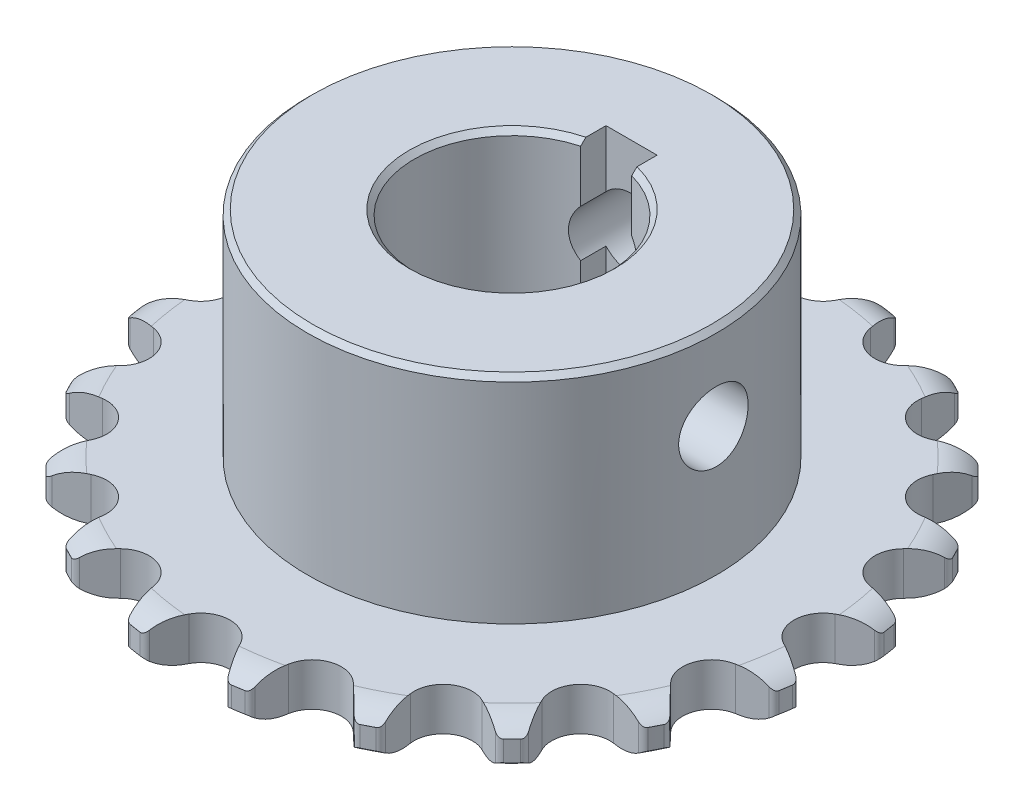
from build123d import *

# Parameters (mm, degrees)
CROQUIS1_R              = 20
CROQUIS1_R_2            = 9.55
SALIENTE_EXTRUIR1_DEPTH = 25.2
CROQUIS2_W              = 5
CROQUIS2_H              = 11.7
CORTAR_EXTRUIR1_DEPTH   = 38.88192181
CROQUIS4_R              = 3.4
CORTAR_EXTRUIR2_DEPTH   = 38.88192181
CROQUIS5_R              = 3.4
CORTAR_EXTRUIR3_DEPTH   = 38.881921982
CROQUIS6_R              = 32.25
CROQUIS6_R_2            = 18
SALIENTE_EXTRUIR2_DEPTH = 4.2
CROQUIS11_R             = 2.85
CORTAR_EXTRUIR9_DEPTH   = 51.210805652
CORTAR_EXTRUIR10_DEPTH  = 51.107839886
REDONDEO4_R             = 0.6
CHAFL_N3_SIZE           = 0.5


with BuildPart() as part:
    # Croquis1 → Saliente-Extruir1 (new body)
    with BuildSketch(Plane(origin=(0, 0, 0), x_dir=(1, 0, 0), z_dir=(0, 1, 0))):
        with Locations(Location((0, 0, 0), (0, 0, 270))):
            Circle(CROQUIS1_R)
        with Locations(Location((0, 0, 0), (0, 0, 270))):
            Circle(CROQUIS1_R_2, mode=Mode.SUBTRACT)
    extrude(amount=SALIENTE_EXTRUIR1_DEPTH)

    # Croquis2 → Cortar-Extruir1 (cut, through all)
    with BuildSketch(Plane(origin=(0, 25.2, 0), x_dir=(1, 0, 0), z_dir=(0, 1, 0))):
        with Locations((0, 5.85)):
            Rectangle(CROQUIS2_W, CROQUIS2_H)
    extrude(amount=-CORTAR_EXTRUIR1_DEPTH, mode=Mode.SUBTRACT)

    # Croquis4 → Cortar-Extruir2 (cut, through all)
    with BuildSketch(Plane.XY):
        with Locations(Location((0, 17.3, 0), (0, 0, 42.667925494))):
            Circle(CROQUIS4_R)
    extrude(amount=-CORTAR_EXTRUIR2_DEPTH, mode=Mode.SUBTRACT)

    # Croquis5 → Cortar-Extruir3 (cut, through all)
    with BuildSketch(Plane(origin=(0, 0, 0), x_dir=(0, 0, -1), z_dir=(1, 0, 0))):
        with Locations(Location((0, 16.8, 0), (0, 0, 180))):
            Circle(CROQUIS5_R)
    extrude(amount=CORTAR_EXTRUIR3_DEPTH, mode=Mode.SUBTRACT)

    # Croquis6 → Saliente-Extruir2 (add)
    with BuildSketch(Plane.XZ):
        with Locations(Location((0, 0, 0), (0, 0, 270))):
            Circle(CROQUIS6_R)
        Circle(CROQUIS6_R_2, mode=Mode.SUBTRACT)
    extrude(amount=-SALIENTE_EXTRUIR2_DEPTH)

    # Croquis11 → Cortar-Extruir9 (cut, through all)
    with BuildSketch(Plane(origin=(0, 4.2, 0), x_dir=(1, 0, 0), z_dir=(0, 1, 0))):
        with Locations((0, 30.45)):
            Circle(CROQUIS11_R)
        with Locations((9.409567479, 28.959670921)):
            Circle(CROQUIS11_R)
        with Locations((17.898060932, 24.634567479)):
            Circle(CROQUIS11_R)
        with Locations((24.634567479, 17.898060932)):
            Circle(CROQUIS11_R)
        with Locations((28.959670921, 9.409567479)):
            Circle(CROQUIS11_R)
        with Locations((30.45, 0)):
            Circle(CROQUIS11_R)
        with Locations((28.959670921, -9.409567479)):
            Circle(CROQUIS11_R)
        with Locations((24.634567479, -17.898060932)):
            Circle(CROQUIS11_R)
        with Locations((17.898060932, -24.634567479)):
            Circle(CROQUIS11_R)
        with Locations((9.409567479, -28.959670921)):
            Circle(CROQUIS11_R)
        with Locations((0, -30.45)):
            Circle(CROQUIS11_R)
        with Locations((-9.409567479, -28.959670921)):
            Circle(CROQUIS11_R)
        with Locations((-17.898060932, -24.634567479)):
            Circle(CROQUIS11_R)
        with Locations((-24.634567479, -17.898060932)):
            Circle(CROQUIS11_R)
        with Locations((-28.959670921, -9.409567479)):
            Circle(CROQUIS11_R)
        with Locations((-30.45, 0)):
            Circle(CROQUIS11_R)
        with Locations((-28.959670921, 9.409567479)):
            Circle(CROQUIS11_R)
        with Locations((-24.634567479, 17.898060932)):
            Circle(CROQUIS11_R)
        with Locations((-17.898060932, 24.634567479)):
            Circle(CROQUIS11_R)
        with Locations((-9.409567479, 28.959670921)):
            Circle(CROQUIS11_R)
    extrude(amount=-CORTAR_EXTRUIR9_DEPTH, mode=Mode.SUBTRACT)

    # Croquis12 → Cortar-Extruir10 (cut, through all)
    with BuildSketch(Plane(origin=(0, 4.2, 0), x_dir=(1, 0, 0), z_dir=(0, 1, 0))):
        with BuildLine():
            Line((2.514154961, 29.107791063), (4.055016529, 31.994051649))
            Line((4.055016529, 31.994051649), (3.555016529, 32.894051649))
            Line((3.555016529, 32.894051649), (2.272596109, 32.169827586))
            ThreePointArc((2.272596109, 32.169827586), (2.841172886, 30.674135296), (2.514154961, 29.107791063))
        make_face()
        with BuildLine():
            Line((6.030392044, 31.681175354), (6.603664339, 28.460263701))
            ThreePointArc((6.603664339, 28.460263701), (6.776750582, 30.050897381), (7.779656092, 31.297594973))
            Line((7.779656092, 31.297594973), (6.530392044, 32.429506831))
            Line((6.530392044, 32.429506831), (6.030392044, 31.681175354))
        make_face()
        with BuildLine():
            Line((11.385905566, 26.906237756), (13.743255572, 29.175082284))
            Line((13.743255572, 29.175082284), (13.545842609, 30.185541646))
            Line((13.545842609, 30.185541646), (12.102390768, 29.893053335))
            ThreePointArc((12.102390768, 29.893053335), (12.180945081, 28.294865549), (11.385905566, 26.906237756))
        make_face()
        with BuildLine():
            Line((15.525265235, 28.26709464), (15.075163149, 25.026674743))
            ThreePointArc((15.075163149, 25.026674743), (15.731310787, 26.485970678), (17.070381351, 27.361735701))
            Line((17.070381351, 27.361735701), (16.232040637, 28.824291671))
            Line((16.232040637, 28.824291671), (15.525265235, 28.26709464))
        make_face()
        with BuildLine():
            Line((19.143124403, 22.07091443), (22.086209005, 23.50025259))
            Line((22.086209005, 23.50025259), (22.210707235, 24.522260511))
            Line((22.210707235, 24.522260511), (20.747519097, 24.690138746))
            ThreePointArc((20.747519097, 24.690138746), (20.328361503, 23.14589722), (19.143124403, 22.07091443))
        make_face()
        with BuildLine():
            Line((23.500417294, 22.086033754), (22.070999955, 19.143300489))
            ThreePointArc((22.070999955, 19.143300489), (23.145980686, 20.328412627), (24.690138746, 20.747519097))
            Line((24.690138746, 20.747519097), (24.344783998, 22.397554011))
            Line((24.344783998, 22.397554011), (23.500417294, 22.086033754))
        make_face()
        with BuildLine():
            Line((25.026480847, 15.075136223), (28.267210417, 15.525054436))
            Line((28.267210417, 15.525054436), (28.701433086, 16.458569661))
            Line((28.701433086, 16.458569661), (27.361735701, 17.070381351))
            ThreePointArc((27.361735701, 17.070381351), (26.485896264, 15.731247205), (25.026480847, 15.075136223))
        make_face()
        with BuildLine():
            Line((29.175184772, 13.743038002), (26.906373508, 11.386046604))
            ThreePointArc((26.906373508, 11.386046604), (28.294960728, 12.180967911), (29.893053335, 12.102390768))
            Line((29.893053335, 12.102390768), (30.074490281, 13.778387711))
            Line((30.074490281, 13.778387711), (29.175184772, 13.743038002))
        make_face()
        with BuildLine():
            Line((28.460070975, 6.603698648), (31.681220324, 6.030155785))
            Line((31.681220324, 6.030155785), (32.382662691, 6.783799338))
            Line((32.382662691, 6.783799338), (31.297594973, 7.779656092))
            ThreePointArc((31.297594973, 7.779656092), (30.05080696, 6.776713107), (28.460070975, 6.603698648))
        make_face()
        with BuildLine():
            Line((31.994081888, 4.054777937), (29.107963754, 2.514247147))
            ThreePointArc((29.107963754, 2.514247147), (30.674232871, 2.841165187), (32.169827586, 2.272596109))
            Line((32.169827586, 2.272596109), (32.860295913, 3.810496823))
            Line((32.860295913, 3.810496823), (31.994081888, 4.054777937))
        make_face()
        with BuildLine():
            Line((29.107791063, -2.514154961), (31.994051649, -4.055016529))
            Line((31.994051649, -4.055016529), (32.894051649, -3.555016529))
            Line((32.894051649, -3.555016529), (32.169827586, -2.272596109))
            ThreePointArc((32.169827586, -2.272596109), (30.674135296, -2.841172886), (29.107791063, -2.514154961))
        make_face()
        with BuildLine():
            Line((31.681175354, -6.030392044), (28.460263701, -6.603664339))
            ThreePointArc((28.460263701, -6.603664339), (30.050897381, -6.776750582), (31.297594973, -7.779656092))
            Line((31.297594973, -7.779656092), (32.429506831, -6.530392044))
            Line((32.429506831, -6.530392044), (31.681175354, -6.030392044))
        make_face()
        with BuildLine():
            Line((26.906237756, -11.385905566), (29.175082284, -13.743255572))
            Line((29.175082284, -13.743255572), (30.185541646, -13.545842609))
            Line((30.185541646, -13.545842609), (29.893053335, -12.102390768))
            ThreePointArc((29.893053335, -12.102390768), (28.294865549, -12.180945081), (26.906237756, -11.385905566))
        make_face()
        with BuildLine():
            Line((28.26709464, -15.525265235), (25.026674743, -15.075163149))
            ThreePointArc((25.026674743, -15.075163149), (26.485970678, -15.731310787), (27.361735701, -17.070381351))
            Line((27.361735701, -17.070381351), (28.824291671, -16.232040637))
            Line((28.824291671, -16.232040637), (28.26709464, -15.525265235))
        make_face()
        with BuildLine():
            Line((22.07091443, -19.143124403), (23.50025259, -22.086209005))
            Line((23.50025259, -22.086209005), (24.522260511, -22.210707235))
            Line((24.522260511, -22.210707235), (24.690138746, -20.747519097))
            ThreePointArc((24.690138746, -20.747519097), (23.14589722, -20.328361503), (22.07091443, -19.143124403))
        make_face()
        with BuildLine():
            Line((22.086033754, -23.500417294), (19.143300489, -22.070999955))
            ThreePointArc((19.143300489, -22.070999955), (20.328412627, -23.145980686), (20.747519097, -24.690138746))
            Line((20.747519097, -24.690138746), (22.397554011, -24.344783998))
            Line((22.397554011, -24.344783998), (22.086033754, -23.500417294))
        make_face()
        with BuildLine():
            Line((15.075136223, -25.026480847), (15.525054436, -28.267210417))
            Line((15.525054436, -28.267210417), (16.458569661, -28.701433086))
            Line((16.458569661, -28.701433086), (17.070381351, -27.361735701))
            ThreePointArc((17.070381351, -27.361735701), (15.731247205, -26.485896264), (15.075136223, -25.026480847))
        make_face()
        with BuildLine():
            Line((13.743038002, -29.175184772), (11.386046604, -26.906373508))
            ThreePointArc((11.386046604, -26.906373508), (12.180967911, -28.294960728), (12.102390768, -29.893053335))
            Line((12.102390768, -29.893053335), (13.778387711, -30.074490281))
            Line((13.778387711, -30.074490281), (13.743038002, -29.175184772))
        make_face()
        with BuildLine():
            Line((6.603698648, -28.460070975), (6.030155785, -31.681220324))
            Line((6.030155785, -31.681220324), (6.783799338, -32.382662691))
            Line((6.783799338, -32.382662691), (7.779656092, -31.297594973))
            ThreePointArc((7.779656092, -31.297594973), (6.776713107, -30.05080696), (6.603698648, -28.460070975))
        make_face()
        with BuildLine():
            Line((4.054777937, -31.994081888), (2.514247147, -29.107963754))
            ThreePointArc((2.514247147, -29.107963754), (2.841165187, -30.674232871), (2.272596109, -32.169827586))
            Line((2.272596109, -32.169827586), (3.810496823, -32.860295913))
            Line((3.810496823, -32.860295913), (4.054777937, -31.994081888))
        make_face()
        with BuildLine():
            Line((-2.514154961, -29.107791063), (-4.055016529, -31.994051649))
            Line((-4.055016529, -31.994051649), (-3.555016529, -32.894051649))
            Line((-3.555016529, -32.894051649), (-2.272596109, -32.169827586))
            ThreePointArc((-2.272596109, -32.169827586), (-2.841172886, -30.674135296), (-2.514154961, -29.107791063))
        make_face()
        with BuildLine():
            Line((-6.030392044, -31.681175354), (-6.603664339, -28.460263701))
            ThreePointArc((-6.603664339, -28.460263701), (-6.776750582, -30.050897381), (-7.779656092, -31.297594973))
            Line((-7.779656092, -31.297594973), (-6.530392044, -32.429506831))
            Line((-6.530392044, -32.429506831), (-6.030392044, -31.681175354))
        make_face()
        with BuildLine():
            Line((-11.385905566, -26.906237756), (-13.743255572, -29.175082284))
            Line((-13.743255572, -29.175082284), (-13.545842609, -30.185541646))
            Line((-13.545842609, -30.185541646), (-12.102390768, -29.893053335))
            ThreePointArc((-12.102390768, -29.893053335), (-12.180945081, -28.294865549), (-11.385905566, -26.906237756))
        make_face()
        with BuildLine():
            Line((-15.525265235, -28.26709464), (-15.075163149, -25.026674743))
            ThreePointArc((-15.075163149, -25.026674743), (-15.731310787, -26.485970678), (-17.070381351, -27.361735701))
            Line((-17.070381351, -27.361735701), (-16.232040637, -28.824291671))
            Line((-16.232040637, -28.824291671), (-15.525265235, -28.26709464))
        make_face()
        with BuildLine():
            Line((-19.143124403, -22.07091443), (-22.086209005, -23.50025259))
            Line((-22.086209005, -23.50025259), (-22.210707235, -24.522260511))
            Line((-22.210707235, -24.522260511), (-20.747519097, -24.690138746))
            ThreePointArc((-20.747519097, -24.690138746), (-20.328361503, -23.14589722), (-19.143124403, -22.07091443))
        make_face()
        with BuildLine():
            Line((-23.500417294, -22.086033754), (-22.070999955, -19.143300489))
            ThreePointArc((-22.070999955, -19.143300489), (-23.145980686, -20.328412627), (-24.690138746, -20.747519097))
            Line((-24.690138746, -20.747519097), (-24.344783998, -22.397554011))
            Line((-24.344783998, -22.397554011), (-23.500417294, -22.086033754))
        make_face()
        with BuildLine():
            Line((-25.026480847, -15.075136223), (-28.267210417, -15.525054436))
            Line((-28.267210417, -15.525054436), (-28.701433086, -16.458569661))
            Line((-28.701433086, -16.458569661), (-27.361735701, -17.070381351))
            ThreePointArc((-27.361735701, -17.070381351), (-26.485896264, -15.731247205), (-25.026480847, -15.075136223))
        make_face()
        with BuildLine():
            Line((-29.175184772, -13.743038002), (-26.906373508, -11.386046604))
            ThreePointArc((-26.906373508, -11.386046604), (-28.294960728, -12.180967911), (-29.893053335, -12.102390768))
            Line((-29.893053335, -12.102390768), (-30.074490281, -13.778387711))
            Line((-30.074490281, -13.778387711), (-29.175184772, -13.743038002))
        make_face()
        with BuildLine():
            Line((-28.460070975, -6.603698648), (-31.681220324, -6.030155785))
            Line((-31.681220324, -6.030155785), (-32.382662691, -6.783799338))
            Line((-32.382662691, -6.783799338), (-31.297594973, -7.779656092))
            ThreePointArc((-31.297594973, -7.779656092), (-30.05080696, -6.776713107), (-28.460070975, -6.603698648))
        make_face()
        with BuildLine():
            Line((-31.994081888, -4.054777937), (-29.107963754, -2.514247147))
            ThreePointArc((-29.107963754, -2.514247147), (-30.674232871, -2.841165187), (-32.169827586, -2.272596109))
            Line((-32.169827586, -2.272596109), (-32.860295913, -3.810496823))
            Line((-32.860295913, -3.810496823), (-31.994081888, -4.054777937))
        make_face()
        with BuildLine():
            Line((-29.107791063, 2.514154961), (-31.994051649, 4.055016529))
            Line((-31.994051649, 4.055016529), (-32.894051649, 3.555016529))
            Line((-32.894051649, 3.555016529), (-32.169827586, 2.272596109))
            ThreePointArc((-32.169827586, 2.272596109), (-30.674135296, 2.841172886), (-29.107791063, 2.514154961))
        make_face()
        with BuildLine():
            Line((-31.681175354, 6.030392044), (-28.460263701, 6.603664339))
            ThreePointArc((-28.460263701, 6.603664339), (-30.050897381, 6.776750582), (-31.297594973, 7.779656092))
            Line((-31.297594973, 7.779656092), (-32.429506831, 6.530392044))
            Line((-32.429506831, 6.530392044), (-31.681175354, 6.030392044))
        make_face()
        with BuildLine():
            Line((-26.906237756, 11.385905566), (-29.175082284, 13.743255572))
            Line((-29.175082284, 13.743255572), (-30.185541646, 13.545842609))
            Line((-30.185541646, 13.545842609), (-29.893053335, 12.102390768))
            ThreePointArc((-29.893053335, 12.102390768), (-28.294865549, 12.180945081), (-26.906237756, 11.385905566))
        make_face()
        with BuildLine():
            Line((-28.26709464, 15.525265235), (-25.026674743, 15.075163149))
            ThreePointArc((-25.026674743, 15.075163149), (-26.485970678, 15.731310787), (-27.361735701, 17.070381351))
            Line((-27.361735701, 17.070381351), (-28.824291671, 16.232040637))
            Line((-28.824291671, 16.232040637), (-28.26709464, 15.525265235))
        make_face()
        with BuildLine():
            Line((-22.07091443, 19.143124403), (-23.50025259, 22.086209005))
            Line((-23.50025259, 22.086209005), (-24.522260511, 22.210707235))
            Line((-24.522260511, 22.210707235), (-24.690138746, 20.747519097))
            ThreePointArc((-24.690138746, 20.747519097), (-23.14589722, 20.328361503), (-22.07091443, 19.143124403))
        make_face()
        with BuildLine():
            Line((-22.086033754, 23.500417294), (-19.143300489, 22.070999955))
            ThreePointArc((-19.143300489, 22.070999955), (-20.328412627, 23.145980686), (-20.747519097, 24.690138746))
            Line((-20.747519097, 24.690138746), (-22.397554011, 24.344783998))
            Line((-22.397554011, 24.344783998), (-22.086033754, 23.500417294))
        make_face()
        with BuildLine():
            Line((-15.075136223, 25.026480847), (-15.525054436, 28.267210417))
            Line((-15.525054436, 28.267210417), (-16.458569661, 28.701433086))
            Line((-16.458569661, 28.701433086), (-17.070381351, 27.361735701))
            ThreePointArc((-17.070381351, 27.361735701), (-15.731247205, 26.485896264), (-15.075136223, 25.026480847))
        make_face()
        with BuildLine():
            Line((-13.743038002, 29.175184772), (-11.386046604, 26.906373508))
            ThreePointArc((-11.386046604, 26.906373508), (-12.180967911, 28.294960728), (-12.102390768, 29.893053335))
            Line((-12.102390768, 29.893053335), (-13.778387711, 30.074490281))
            Line((-13.778387711, 30.074490281), (-13.743038002, 29.175184772))
        make_face()
        with BuildLine():
            Line((-6.603698648, 28.460070975), (-6.030155785, 31.681220324))
            Line((-6.030155785, 31.681220324), (-6.783799338, 32.382662691))
            Line((-6.783799338, 32.382662691), (-7.779656092, 31.297594973))
            ThreePointArc((-7.779656092, 31.297594973), (-6.776713107, 30.05080696), (-6.603698648, 28.460070975))
        make_face()
        with BuildLine():
            Line((-4.054777937, 31.994081888), (-2.514247147, 29.107963754))
            ThreePointArc((-2.514247147, 29.107963754), (-2.841165187, 30.674232871), (-2.272596109, 32.169827586))
            Line((-2.272596109, 32.169827586), (-3.810496823, 32.860295913))
            Line((-3.810496823, 32.860295913), (-4.054777937, 31.994081888))
        make_face()
    extrude(amount=-CORTAR_EXTRUIR10_DEPTH, mode=Mode.SUBTRACT)

    # Redondeo4
    redondeo4_edges = [part.edges().sort_by_distance(p)[0] for p in [
        (13.743038002, 2.1, 29.175184772),
        (6.030155785, 2.1, 31.681220324),
        (4.054777937, 2.1, 31.994081888),
        (-4.055016529, 2.1, 31.994051649),
        (-6.030392044, 2.1, 31.681175354),
        (-13.743255572, 2.1, 29.175082284),
        (-15.525265235, 2.1, 28.26709464),
        (-22.086209005, 2.1, 23.50025259),
        (-23.500417294, 2.1, 22.086033754),
        (-28.267210417, 2.1, 15.525054436),
        (-29.175184772, 2.1, 13.743038002),
        (-31.681220324, 2.1, 6.030155785),
        (-31.994081888, 2.1, 4.054777937),
        (-31.994051649, 2.1, -4.055016529),
        (-31.681175354, 2.1, -6.030392044),
        (-29.175082284, 2.1, -13.743255572),
        (28.26709464, 2.1, 15.525265235),
        (23.50025259, 2.1, 22.086209005),
        (22.086033754, 2.1, 23.500417294),
        (15.525054436, 2.1, 28.267210417),
        (29.175082284, 2.1, 13.743255572),
        (31.681175354, 2.1, 6.030392044),
        (31.994051649, 2.1, 4.055016529),
        (31.994081888, 2.1, -4.054777937),
        (6.030392044, 2.1, -31.681175354),
        (13.743255572, 2.1, -29.175082284),
        (15.525265235, 2.1, -28.26709464),
        (22.086209005, 2.1, -23.50025259),
        (23.500417294, 2.1, -22.086033754),
        (28.267210417, 2.1, -15.525054436),
        (29.175184772, 2.1, -13.743038002),
        (31.681220324, 2.1, -6.030155785),
        (-15.525054436, 2.1, -28.267210417),
        (-22.086033754, 2.1, -23.500417294),
        (-23.50025259, 2.1, -22.086209005),
        (-28.26709464, 2.1, -15.525265235),
        (-13.743038002, 2.1, -29.175184772),
        (-6.030155785, 2.1, -31.681220324),
        (-4.054777937, 2.1, -31.994081888),
        (4.055016529, 2.1, -31.994051649),
    ]]
    fillet(redondeo4_edges, radius=REDONDEO4_R)

    # Croquis16 → Cortar-Revolución3 (revolve, cut)
    with BuildSketch(Plane(origin=(5.044906386, 4.2, 31.852965632), x_dir=(0.1564312057819887, 0, 0.9876888568054178), z_dir=(-0.9876888568054178, 0, 0.1564312057819887)), mode=Mode.PRIVATE) as cortar_revoluci_n3_sk:
        with BuildLine():
            Line((-0.00521521, -1.1), (0.19478479, -1.1))
            Line((0.19478479, -1.1), (0.19478479, 0))
            Line((0.19478479, 0), (-2.760210672, 0))
            ThreePointArc((-2.760210672, 0), (-1.276970975, -0.285164876), (-0.00521521, -1.1))
        make_face()
        with BuildLine():
            Line((0.19478479, -3.1), (0.19478479, -4.2))
            Line((0.19478479, -4.2), (-2.760210672, -4.2))
            ThreePointArc((-2.760210672, -4.2), (-1.276970975, -3.914835124), (-0.00521521, -3.1))
            Line((-0.00521521, -3.1), (0.19478479, -3.1))
        make_face()
    revolve(cortar_revoluci_n3_sk.sketch.rotate(Axis((0, 0, 0), (0, 1, 0)), 171.000189069), axis=Axis((0, 0, 0), (0, 1, 0)), mode=Mode.SUBTRACT)

    # Chaflán3
    chafl_n3_edges = [part.edges().sort_by_distance(p)[0] for p in [
        (0, 25.2, 9.55),
        (0, 0, 9.55),
        (0, 25.2, -20),
    ]]
    chamfer(chafl_n3_edges, length=CHAFL_N3_SIZE)


solid = part.part
